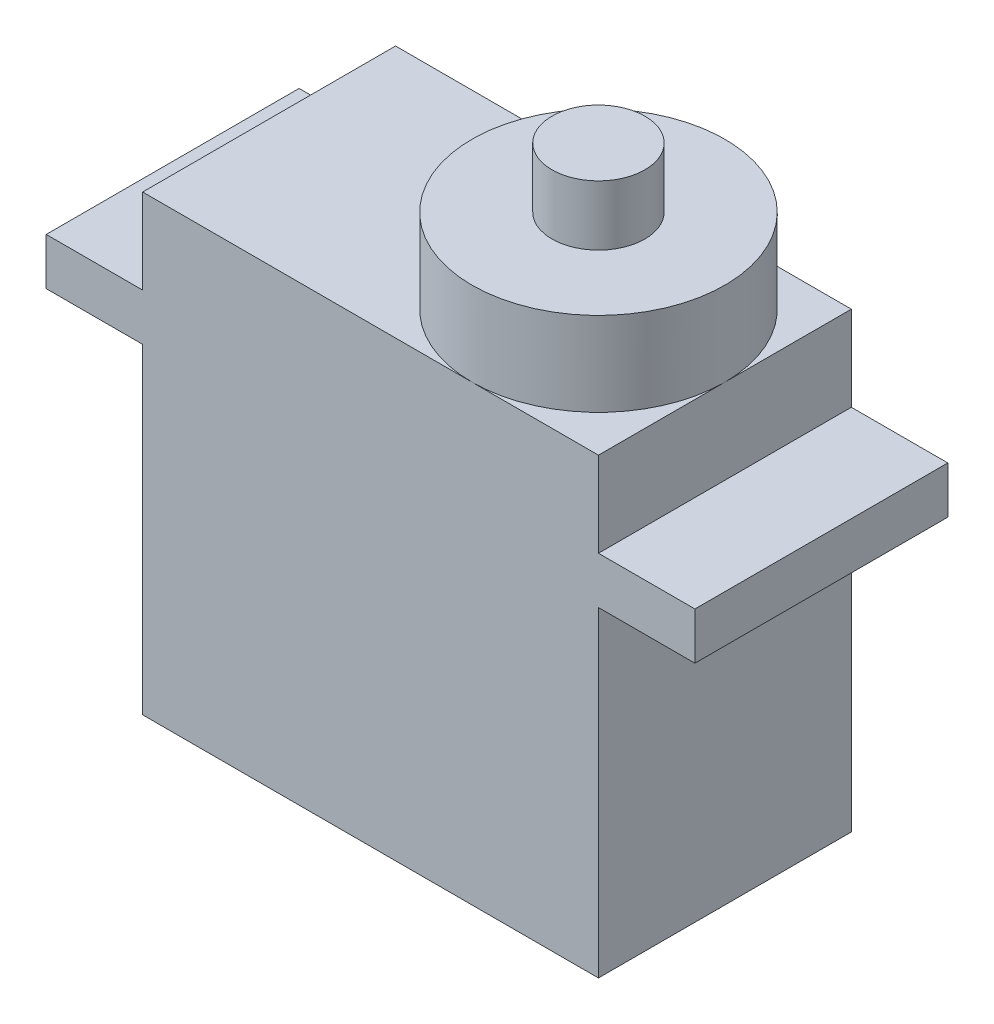
from build123d import *

# Parameters (mm, degrees)
SKETCH1_W           = 22.8
SKETCH1_H           = 12.65
BOSS_EXTRUDE1_DEPTH = 16.05
SKETCH1_3_W         = 32.45
SKETCH1_3_H         = 12.65
BOSS_EXTRUDE2_DEPTH = 2.35
SKETCH1_4_W         = 22.8
SKETCH1_4_H         = 12.65
BOSS_EXTRUDE3_DEPTH = 6.6
SKETCH1_5_R         = 6.325
BOSS_EXTRUDE4_DEPTH = 10.8
SKETCH1_6_R         = 2.325
BOSS_EXTRUDE5_DEPTH = 13.8


with BuildPart() as part:
    # Sketch1 → Boss-Extrude1 (new body)
    with BuildSketch(Plane(origin=(0, 0, 0), x_dir=(1, 0, 0), z_dir=(0, 1, 0))):
        Rectangle(SKETCH1_W, SKETCH1_H)
    extrude(amount=-BOSS_EXTRUDE1_DEPTH)

    # Sketch1<3> → Boss-Extrude2 (add)
    with BuildSketch(Plane(origin=(0, 0, 0), x_dir=(1, 0, 0), z_dir=(0, 1, 0))):
        Rectangle(SKETCH1_3_W, SKETCH1_3_H)
    extrude(amount=BOSS_EXTRUDE2_DEPTH)

    # Sketch1<4> → Boss-Extrude3 (add)
    with BuildSketch(Plane(origin=(0, 0, 0), x_dir=(1, 0, 0), z_dir=(0, 1, 0))):
        Rectangle(SKETCH1_4_W, SKETCH1_4_H)
    extrude(amount=BOSS_EXTRUDE3_DEPTH)

    # Sketch1<5> → Boss-Extrude4 (add)
    with BuildSketch(Plane(origin=(0, 0, 0), x_dir=(1, 0, 0), z_dir=(0, 1, 0))):
        with Locations((5.075, 0)):
            Circle(SKETCH1_5_R)
    extrude(amount=BOSS_EXTRUDE4_DEPTH)

    # Sketch1<6> → Boss-Extrude5 (add)
    with BuildSketch(Plane(origin=(0, 0, 0), x_dir=(1, 0, 0), z_dir=(0, 1, 0))):
        with Locations((5.075, 0)):
            Circle(SKETCH1_6_R)
    extrude(amount=BOSS_EXTRUDE5_DEPTH)


solid = part.part
